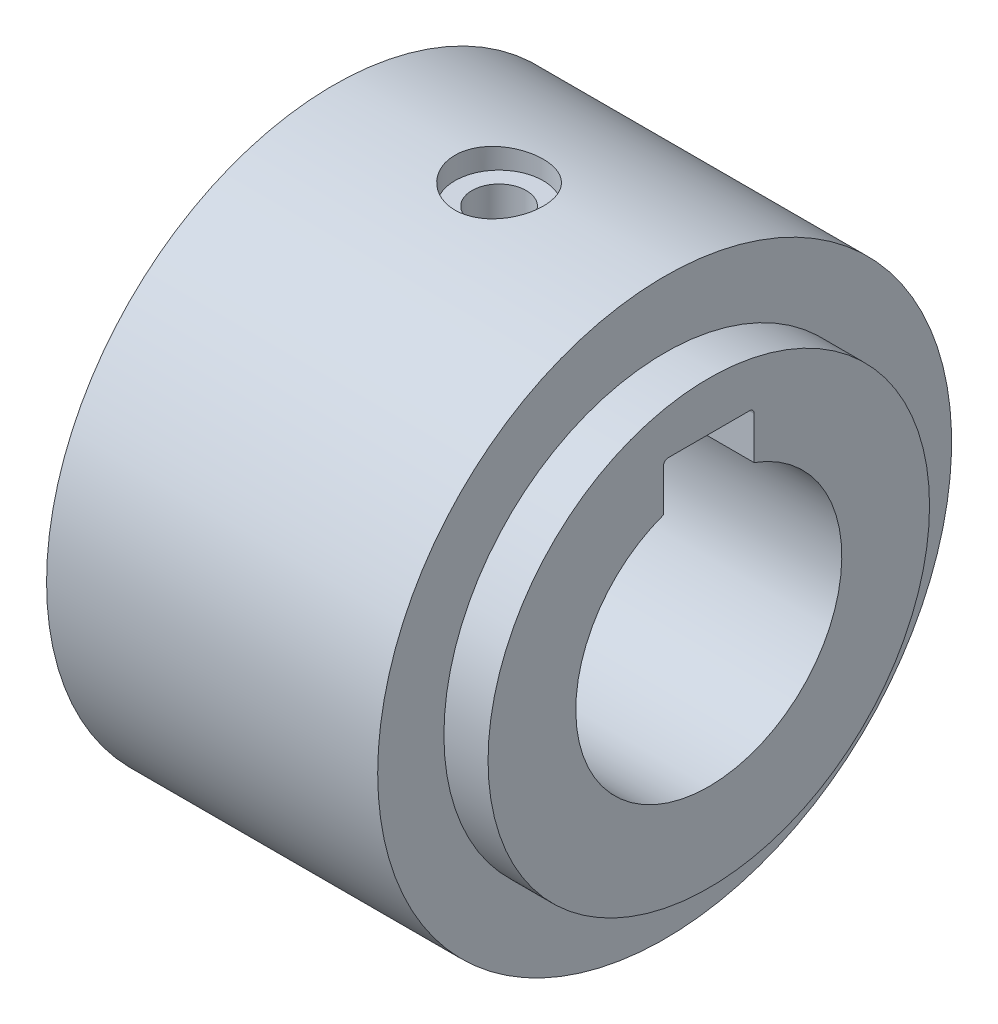
from build123d import *

# Parameters (mm, degrees)
CUT_EXTRUDE1_DEPTH                               = 27.438608133
SKETCH3_W                                        = 19
SKETCH3_H                                        = 6.025
CBORE_FOR_M2_HEX_HEAD_MACHINE_SCREW2_D           = 2.459
CBORE_FOR_M2_HEX_HEAD_MACHINE_SCREW2_DEPTH       = 27.463932023
CBORE_FOR_M2_HEX_HEAD_MACHINE_SCREW2_CBORE_D     = 4
CBORE_FOR_M2_HEX_HEAD_MACHINE_SCREW2_CBORE_DEPTH = 23.263932023
FILLET1_R                                        = 0.2


with BuildPart() as part:
    # Sketch1 → Revolve1 (revolve)
    with BuildSketch(Plane(origin=(0, 0, 0), x_dir=(-1, 0, 0), z_dir=(0, 0, -1)), mode=Mode.PRIVATE) as revolve1_sk:
        Polygon((-9.5, 10), (-9.5, 0), (9.5, 0), (9.5, 10), (7.5, 10), (7.5, 13), (-7.5, 13), (-7.5, 10), align=None)
    revolve(revolve1_sk.sketch.rotate(Axis((9.5, 0, 0), (-1, 0, 0)), 270), axis=Axis((9.5, 0, 0), (-1, 0, 0)))

    # Sketch2 → Cut-Extrude1 (cut, through all)
    with BuildSketch(Plane.ZY.offset(9.5)):
        with BuildLine():
            Line((2.05, 5.638927203), (2.05, 7.8))
            Line((2.05, 7.8), (-2.05, 7.8))
            Line((-2.05, 7.8), (-2.05, 5.638927203))
            ThreePointArc((-2.05, 5.638927203), (0, 6), (2.05, 5.638927203))
        make_face()
    extrude(amount=-CUT_EXTRUDE1_DEPTH, mode=Mode.SUBTRACT)

    # Sketch3 → 0.5mm clearance (revolve, cut)
    with BuildSketch(Plane(origin=(0, 0, 0), x_dir=(-1, 0, 0), z_dir=(0, 0, -1))):
        with Locations((0, 3.0125)):
            Rectangle(SKETCH3_W, SKETCH3_H)
    revolve(axis=Axis((9.5, 0, 0), (-1, 0, 0)), mode=Mode.SUBTRACT)

    # CBORE for M2 Hex Head Machine Screw2
    with Locations(Plane(origin=(0, 35.263932023, 0), x_dir=(1, 0, 0), z_dir=(0, 1, 0))):
        with Locations((0, 0)):
            CounterBoreHole(CBORE_FOR_M2_HEX_HEAD_MACHINE_SCREW2_D / 2, CBORE_FOR_M2_HEX_HEAD_MACHINE_SCREW2_CBORE_D / 2, CBORE_FOR_M2_HEX_HEAD_MACHINE_SCREW2_CBORE_DEPTH, depth=CBORE_FOR_M2_HEX_HEAD_MACHINE_SCREW2_DEPTH)

    # Fillet1
    fillet1_edges = [part.edges().sort_by_distance(p)[0] for p in [
        (0, 7.8, -2.05),
        (0, 7.8, 2.05),
    ]]
    fillet(fillet1_edges, radius=FILLET1_R)


solid = part.part
